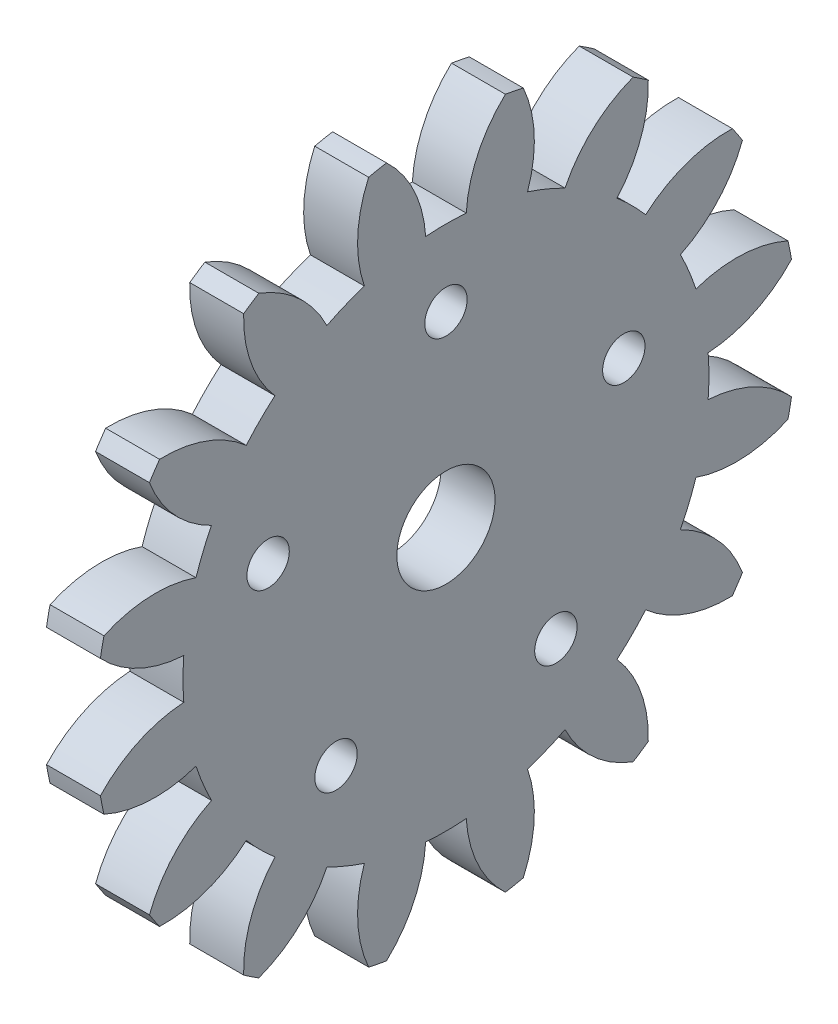
from build123d import *

# Parameters (mm, degrees)
BASPROSKE_W        = 11.811
BASPROSKE_H        = 28.575
TOOTHCUT_DEPTH     = 43.101792967
TEETHCUTS_COUNT    = 16
TEETHCUTS_ANGLE    = 337.5
BORSKE_R           = 0.396875
BORE_DEPTH         = 50.8000508
SKETCH1_R          = 4
CUT_EXTRUDE1_DEPTH = 42.540449503
SKETCH2_R          = 1.7272
CUT_EXTRUDE2_DEPTH = 42.540449503
SKETCH3_W          = 75.062540623
SKETCH3_H          = 68.403246839
CUT_EXTRUDE3_DEPTH = 7.4168


with BuildPart() as part:
    # BasProSke → Base-Revolve (revolve)
    with BuildSketch(Plane(origin=(0, 0, 0), x_dir=(1, 0, 0), z_dir=(0, 1, 0)), mode=Mode.PRIVATE) as base_revolve_sk:
        with Locations((5.9055, 14.2875)):
            Rectangle(BASPROSKE_W, BASPROSKE_H)
    revolve(base_revolve_sk.sketch.rotate(Axis((-10, 0, 0), (1, 0, 0)), 180), axis=Axis((-10, 0, 0), (1, 0, 0)))

    # TooCutSke → ToothCut (cut, through all)
    with BuildSketch(Plane(origin=(0, 0, 0), x_dir=(0, 0, -1), z_dir=(1, 0, 0))):
        with BuildLine():
            ThreePointArc((1.653773222, 21.366073035), (0, 21.42998), (-1.653773222, 21.366073035))
            ThreePointArc((-1.653773222, 21.366073035), (-2.605634946, 25.083646688), (-4.868483936, 28.182986789))
            ThreePointArc((-4.868483936, 28.182986789), (0, 28.6004), (4.868483936, 28.182986789))
            ThreePointArc((4.868483936, 28.182986789), (2.605634946, 25.083646688), (1.653773222, 21.366073035))
        make_face()
    toothcut = extrude(amount=TOOTHCUT_DEPTH, mode=Mode.SUBTRACT)

    # TeethCuts: ToothCut ×16 about axis
    teethcuts_axis = Axis((-10, 0, 0), (1, 0, 0))
    for i in range(1, TEETHCUTS_COUNT):
        add(toothcut.rotate(teethcuts_axis, i * TEETHCUTS_ANGLE / (TEETHCUTS_COUNT - 1)), mode=Mode.SUBTRACT)

    # BorSke → Bore (cut, symmetric)
    with BuildSketch(Plane(origin=(0, 0, 0), x_dir=(0, 0, -1), z_dir=(1, 0, 0))):
        with Locations(Location((0, 0, 0), (0, 0, 180))):
            Circle(BORSKE_R)
    extrude(amount=BORE_DEPTH, both=True, mode=Mode.SUBTRACT)

    # Sketch1 → Cut-Extrude1 (cut, through all)
    with BuildSketch(Plane(origin=(11.811, 0, 0), x_dir=(0, 0, -1), z_dir=(1, 0, 0))):
        Circle(SKETCH1_R)
    extrude(amount=-CUT_EXTRUDE1_DEPTH, mode=Mode.SUBTRACT)

    # Sketch2 → Cut-Extrude2 (cut, through all)
    with BuildSketch(Plane(origin=(11.811, 0, 0), x_dir=(0, 0, -1), z_dir=(1, 0, 0))):
        with Locations((0, 15.24)):
            Circle(SKETCH2_R)
        with Locations((14.494101308, 4.709418994)):
            Circle(SKETCH2_R)
        with Locations((8.957847245, -12.329418994)):
            Circle(SKETCH2_R)
        with Locations((-8.957847245, -12.329418994)):
            Circle(SKETCH2_R)
        with Locations((-14.494101308, 4.709418994)):
            Circle(SKETCH2_R)
    extrude(amount=-CUT_EXTRUDE2_DEPTH, mode=Mode.SUBTRACT)

    # Sketch3 → Cut-Extrude3 (cut)
    with BuildSketch(Plane.ZY):
        with Locations((-0.516013304, 2.685244596)):
            Rectangle(SKETCH3_W, SKETCH3_H)
    extrude(amount=-CUT_EXTRUDE3_DEPTH, mode=Mode.SUBTRACT)


solid = part.part
